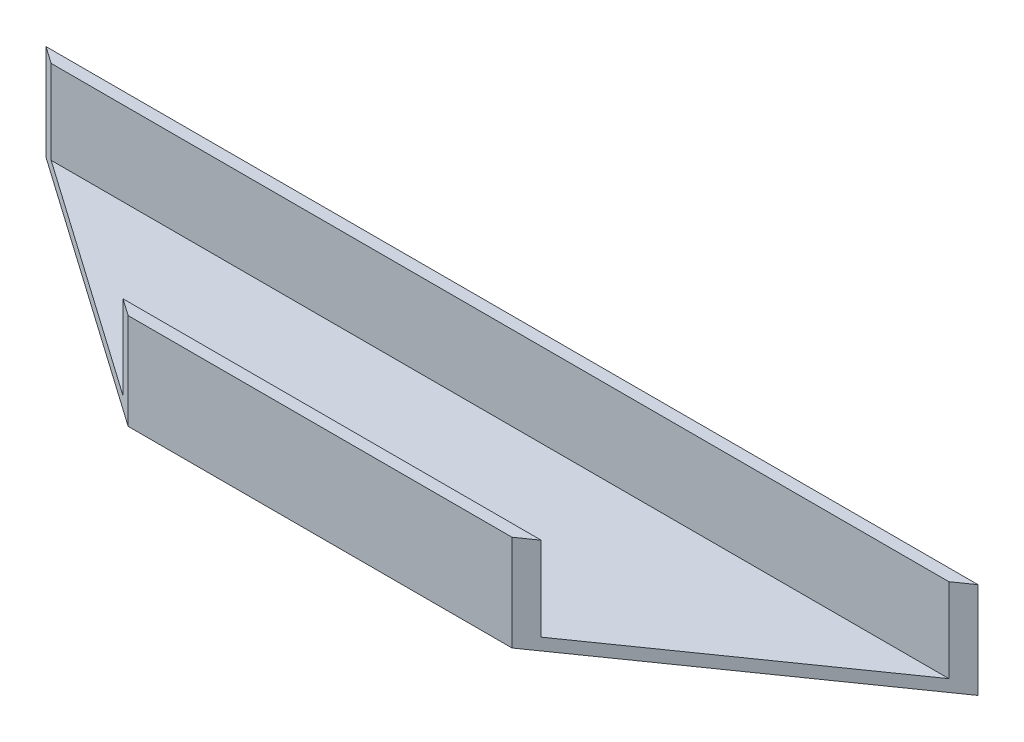
from build123d import *

# Parameters (mm, degrees)
BOSS_EXTRUDE1_DEPTH = 406.4
CUT_EXTRUDE1_DEPTH  = 408.984411467


with BuildPart() as part:
    # Sketch1 → Boss-Extrude1 (new body)
    with BuildSketch(Plane(origin=(0, 0, 0), x_dir=(0, 0, -1), z_dir=(1, 0, 0))):
        Polygon((-22.225, -9.525), (-22.225, 12.7), (-25.4, 12.7), (-25.4, -12.7), (25.4, -12.7), (25.4, 12.7), (22.225, 12.7), (22.225, -9.525), align=None)
    extrude(amount=BOSS_EXTRUDE1_DEPTH)

    # Sketch2 → Cut-Extrude1 (cut, through all)
    with BuildSketch(Plane(origin=(0, 12.7, 0), x_dir=(1, 0, 0), z_dir=(0, 1, 0))):
        Polygon((203.2, -25.4), (152.4, -25.4), (79.850081258, 25.4), (-62.210264403, 25.4), (-62.210264403, -94.274139353), (523.373076947, -141.453594379), (523.373076947, 25.4), (326.549918742, 25.4), (254, -25.4), align=None)
    extrude(amount=-CUT_EXTRUDE1_DEPTH, mode=Mode.SUBTRACT)


solid = part.part
